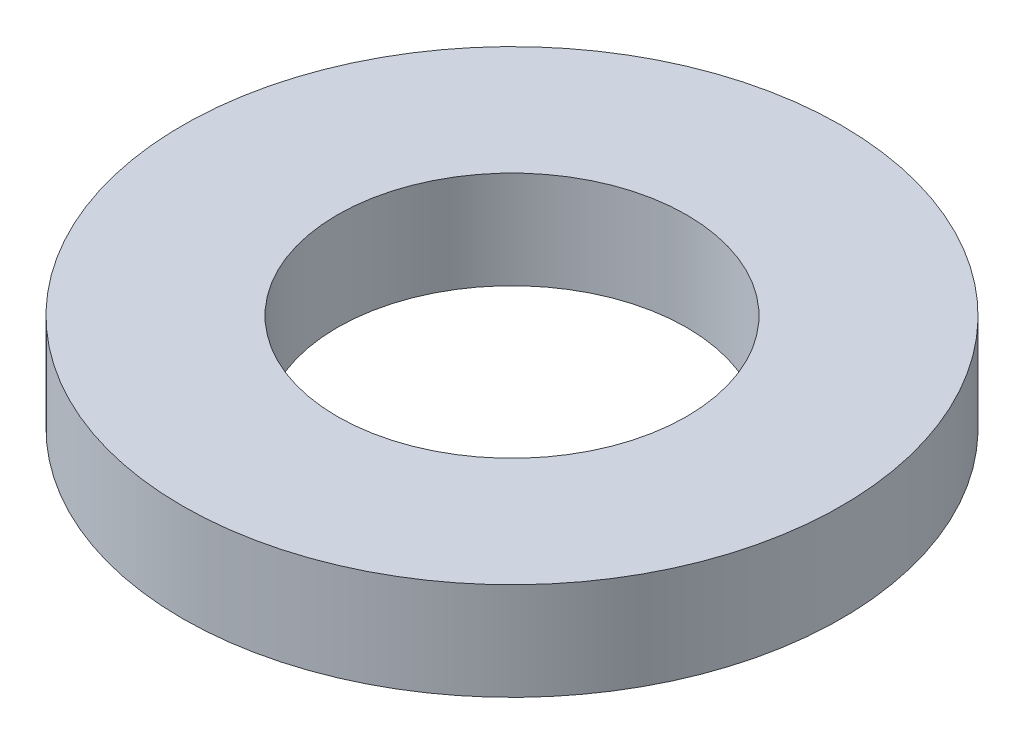
from build123d import *

# Parameters (mm, degrees)
SKETCH1_R           = 6.35
BOSS_EXTRUDE1_DEPTH = 1.8796
SKETCH5_R           = 3.3655
CUT_EXTRUDE1_DEPTH  = 10.174851288


with BuildPart() as part:
    # Sketch1 → Boss-Extrude1 (new body)
    with BuildSketch(Plane(origin=(0, 0, 0), x_dir=(1, 0, 0), z_dir=(0, 1, 0))):
        with Locations(Location((0, 0, 0), (0, 0, 270))):
            Circle(SKETCH1_R)
    extrude(amount=BOSS_EXTRUDE1_DEPTH)

    # Sketch5 → Cut-Extrude1 (cut, through all)
    with BuildSketch(Plane(origin=(0, 1.8796, 0), x_dir=(-1, 0, 0), z_dir=(0, 1, 0))):
        with Locations(Location((0, 0, 0), (0, 0, 90))):
            Circle(SKETCH5_R)
    extrude(amount=-CUT_EXTRUDE1_DEPTH, mode=Mode.SUBTRACT)


solid = part.part
